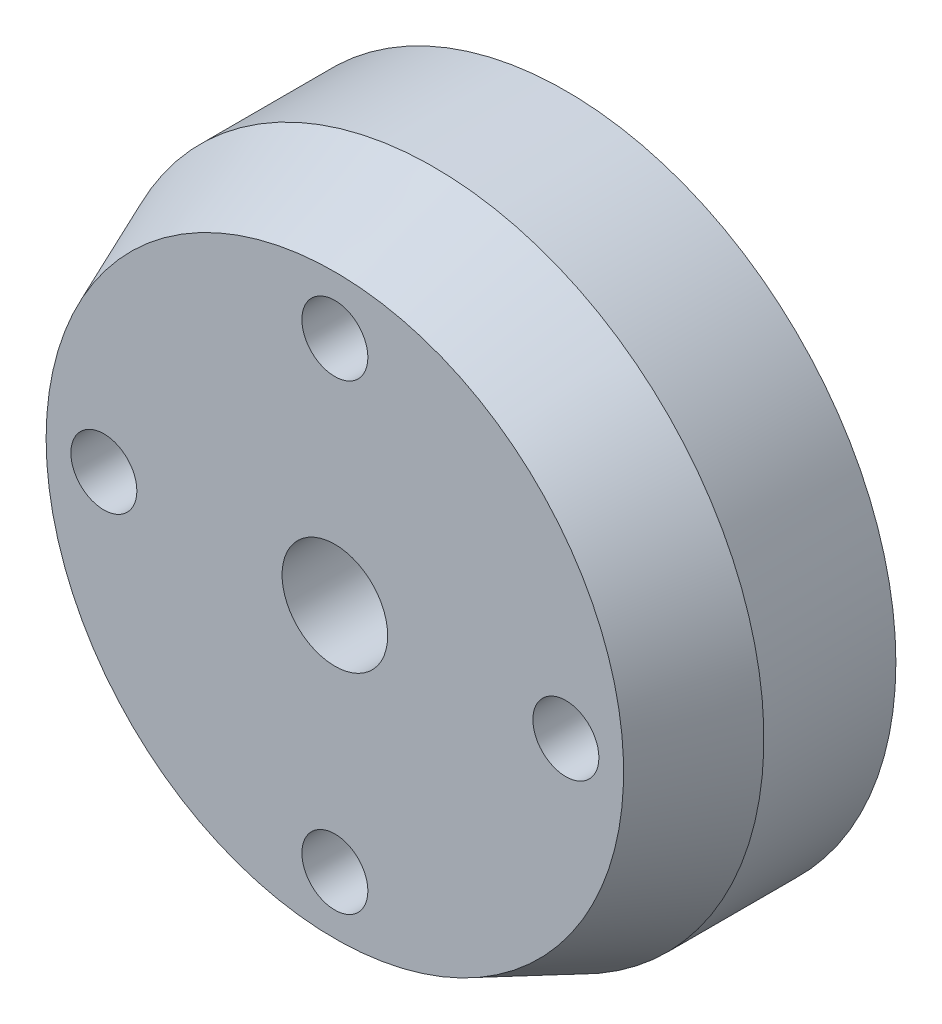
from build123d import *

# Parameters (mm, degrees)
SKETCH1_R           = 10
SKETCH1_R_2         = 1.6
BOSS_EXTRUDE1_DEPTH = 7
SKETCH2_R           = 1
CUT_EXTRUDE1_DEPTH  = 7
CHAMFER2_SIZE       = 3
CHAMFER2_SIZE2      = 1.25


with BuildPart() as part:
    # Sketch1 → Boss-Extrude1 (new body)
    with BuildSketch(Plane.XY):
        Circle(SKETCH1_R)
        Circle(SKETCH1_R_2, mode=Mode.SUBTRACT)
    extrude(amount=BOSS_EXTRUDE1_DEPTH)

    # Sketch2 → Cut-Extrude1 (cut)
    with BuildSketch(Plane.XY.offset(7)):
        with Locations((7, 0)):
            Circle(SKETCH2_R)
        with Locations((0, -7)):
            Circle(SKETCH2_R)
        with Locations((-7, 0)):
            Circle(SKETCH2_R)
        with Locations((0, 7)):
            Circle(SKETCH2_R)
    extrude(amount=-CUT_EXTRUDE1_DEPTH, mode=Mode.SUBTRACT)

    # Chamfer2
    chamfer2_edges = [part.edges().sort_by_distance(p)[0] for p in [
        (-10, 0, 7),
    ]]
    chamfer2_side = [part.faces().sort_by_distance(p)[0] for p in [
        (-10, 0, 3.5),
    ]]
    chamfer(chamfer2_edges, length=CHAMFER2_SIZE, length2=CHAMFER2_SIZE2, reference=chamfer2_side[0])


solid = part.part
